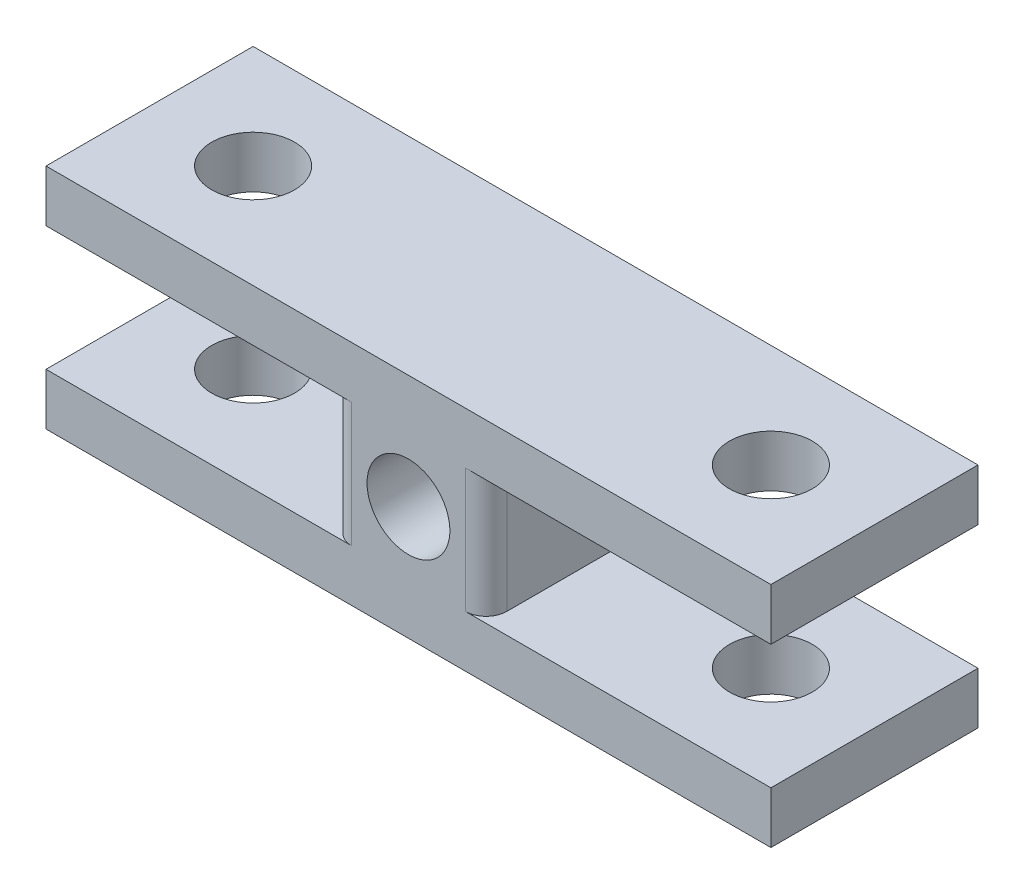
from build123d import *

# Parameters (mm, degrees)
SKETCH1_W           = 70
SKETCH1_H           = 20
SKETCH1_R           = 4
BOSS_EXTRUDE1_DEPTH = 5
SKETCH2_W           = 15
SKETCH2_H           = 20
BOSS_EXTRUDE2_DEPTH = 6
SKETCH3_R           = 4
CUT_EXTRUDE1_DEPTH  = 46.923850013
FILLET1_R           = 2


with BuildPart() as part:
    # Sketch1 → Boss-Extrude1 (new body)
    with BuildSketch(Plane(origin=(0, 0, 0), x_dir=(1, 0, 0), z_dir=(0, 1, 0))):
        Rectangle(SKETCH1_W, SKETCH1_H)
        with Locations(Location((-25, 0, 0), (0, 0, 270))):
            Circle(SKETCH1_R, mode=Mode.SUBTRACT)
        with Locations(Location((25, 0, 0), (0, 0, 90))):
            Circle(SKETCH1_R, mode=Mode.SUBTRACT)
    boss_extrude1 = extrude(amount=BOSS_EXTRUDE1_DEPTH)

    # Sketch2 → Boss-Extrude2 (add)
    with BuildSketch(Plane(origin=(0, 5, 0), x_dir=(1, 0, 0), z_dir=(0, 1, 0))):
        Rectangle(SKETCH2_W, SKETCH2_H)
    boss_extrude2 = extrude(amount=BOSS_EXTRUDE2_DEPTH)

    # Mirror3: Boss-Extrude2 across plane
    add(boss_extrude2.mirror(Plane.ZX.offset(11)))

    # Mirror4: Boss-Extrude1 across plane
    add(boss_extrude1.mirror(Plane.ZX.offset(11)))

    # Sketch3 → Cut-Extrude1 (cut, through all)
    with BuildSketch(Plane(origin=(0, 0, -10), x_dir=(-1, 0, 0), z_dir=(0, 0, -1))):
        with Locations((0, 11)):
            Circle(SKETCH3_R)
    extrude(amount=-CUT_EXTRUDE1_DEPTH, mode=Mode.SUBTRACT)

    # Fillet1
    fillet1_edges = [part.edges().sort_by_distance(p)[0] for p in [
        (7.5, 11, 10),
        (7.5, 11, -10),
        (-7.5, 11, -10),
        (-7.5, 11, 10),
    ]]
    fillet(fillet1_edges, radius=FILLET1_R)


solid = part.part
